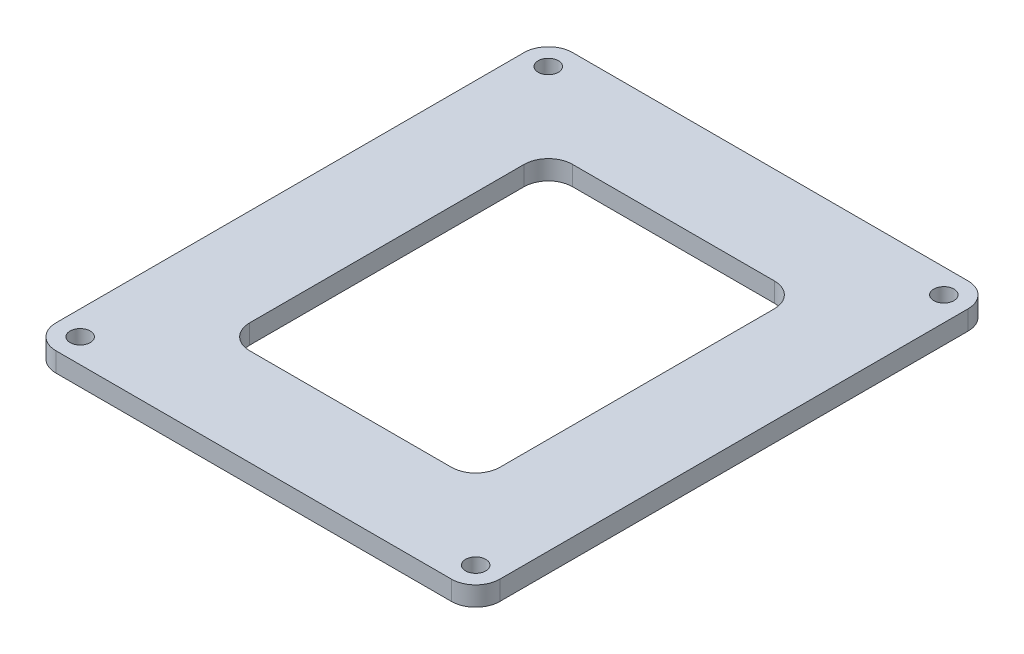
from build123d import *

# Parameters (mm, degrees)
SKETCH_1_W      = 55
SKETCH_1_H      = 64
SKETCH_1_R      = 1.25
SKETCH_1_W_2    = 31
SKETCH_1_H_2    = 40
EXTRUDE_1_DEPTH = 2.4
FILLET_1_R      = 3


with BuildPart() as part:
    # 草图1 → 凸台-拉伸1 (new body)
    with BuildSketch(Plane(origin=(0, 0, 0), x_dir=(1, 0, 0), z_dir=(0, 1, 0))):
        Rectangle(SKETCH_1_W, SKETCH_1_H)
        with Locations(Location((-24.5, 29, 0), (0, 0, 270))):
            Circle(SKETCH_1_R, mode=Mode.SUBTRACT)
        with Locations(Location((24.5, 29, 0), (0, 0, 90))):
            Circle(SKETCH_1_R, mode=Mode.SUBTRACT)
        with Locations(Location((24.5, -29, 0), (0, 0, 270))):
            Circle(SKETCH_1_R, mode=Mode.SUBTRACT)
        with Locations(Location((-24.5, -29, 0), (0, 0, 90))):
            Circle(SKETCH_1_R, mode=Mode.SUBTRACT)
        Rectangle(SKETCH_1_W_2, SKETCH_1_H_2, mode=Mode.SUBTRACT)
    extrude(amount=EXTRUDE_1_DEPTH)

    # 圆角1
    fillet_1_edges = [part.edges().sort_by_distance(p)[0] for p in [
        (-15.5, 1.2, 20),
        (15.5, 1.2, 20),
        (15.5, 1.2, -20),
        (-15.5, 1.2, -20),
        (27.5, 1.2, 32),
        (-27.5, 1.2, 32),
        (-27.5, 1.2, -32),
        (27.5, 1.2, -32),
    ]]
    fillet(fillet_1_edges, radius=FILLET_1_R)


solid = part.part
